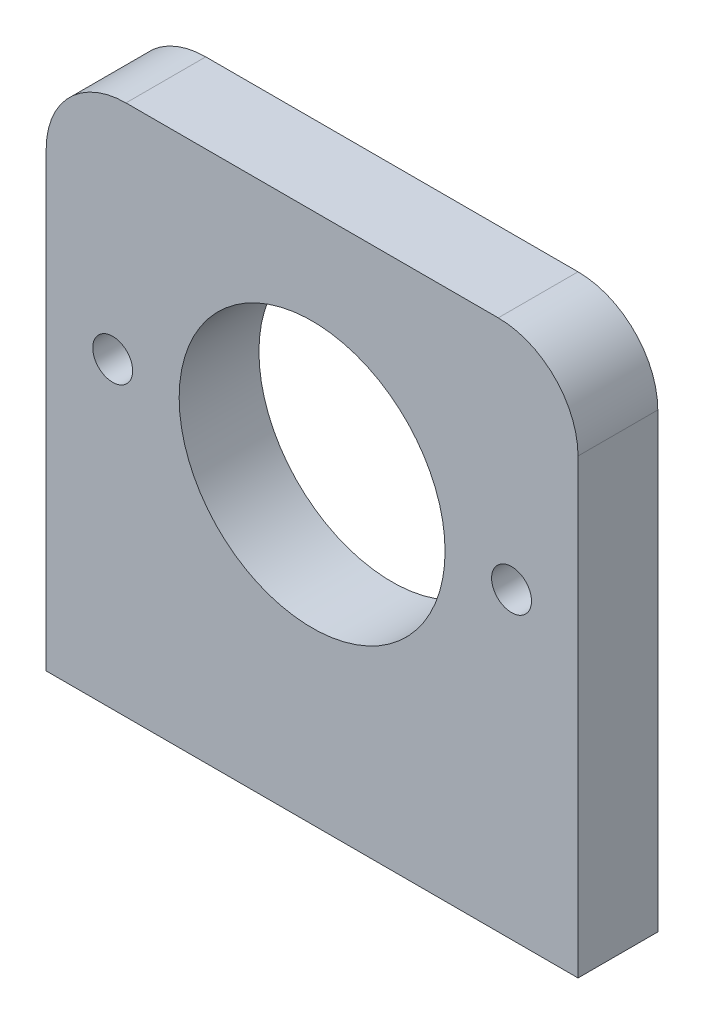
from build123d import *

# Parameters (mm, degrees)
SKETCH1_R           = 25
SKETCH1_R_2         = 3.75
BOSS_EXTRUDE1_DEPTH = 15


with BuildPart() as part:
    # Sketch1 → Boss-Extrude1 (new body)
    with BuildSketch(Plane.XY):
        with BuildLine():
            Line((-50, -57), (50, -57))
            Line((50, -57), (50, 28))
            ThreePointArc((50, 28), (45.606601718, 38.606601718), (35, 43))
            Line((35, 43), (-35, 43))
            ThreePointArc((-35, 43), (-45.606601718, 38.606601718), (-50, 28))
            Line((-50, 28), (-50, -57))
        make_face()
        Circle(SKETCH1_R, mode=Mode.SUBTRACT)
        with Locations((-37.5, 0)):
            Circle(SKETCH1_R_2, mode=Mode.SUBTRACT)
        with Locations(Location((37.5, 0, 0), (0, 0, 180))):
            Circle(SKETCH1_R_2, mode=Mode.SUBTRACT)
    extrude(amount=BOSS_EXTRUDE1_DEPTH)


solid = part.part
